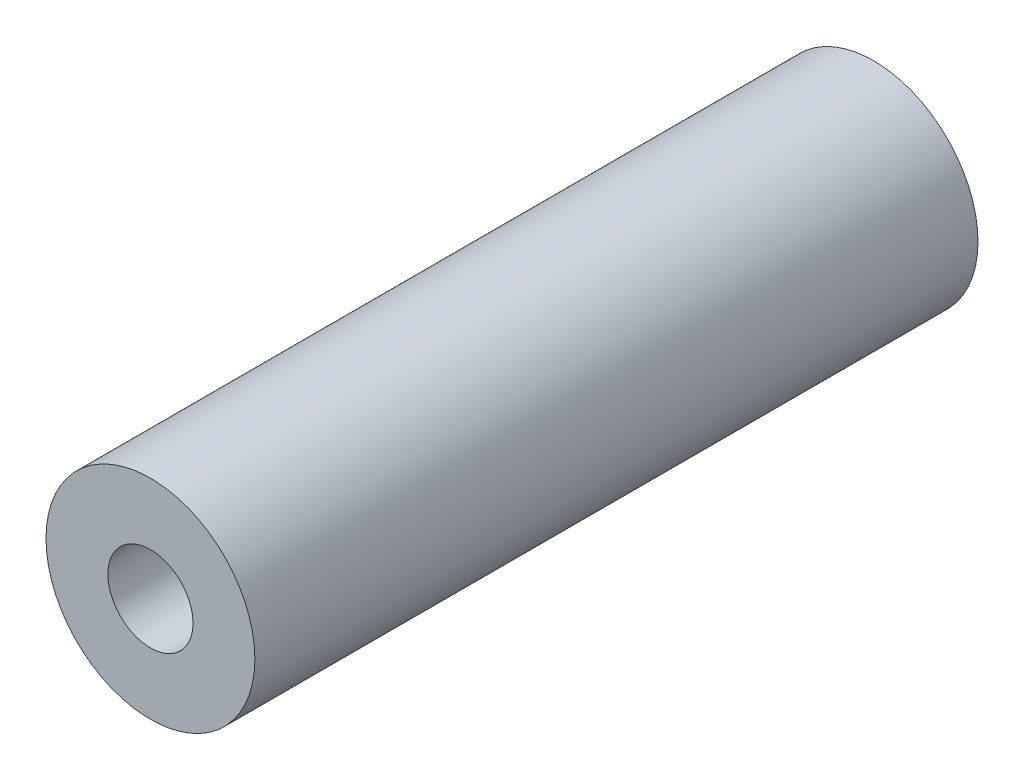
from build123d import *

# Parameters (mm, degrees)
SKETCH1_R      = 6.5
SKETCH1_R_2    = 2.65
EXTRUDE1_DEPTH = 22.5


with BuildPart() as part:
    # Sketch1 → Extrude1 (new, symmetric)
    with BuildSketch(Plane.XY):
        with Locations(Location((0, 0, 0), (0, 0, 180))):
            Circle(SKETCH1_R)
        with Locations(Location((0, 0, 0), (0, 0, 180))):
            Circle(SKETCH1_R_2, mode=Mode.SUBTRACT)
    extrude(amount=EXTRUDE1_DEPTH, both=True)


solid = part.part
